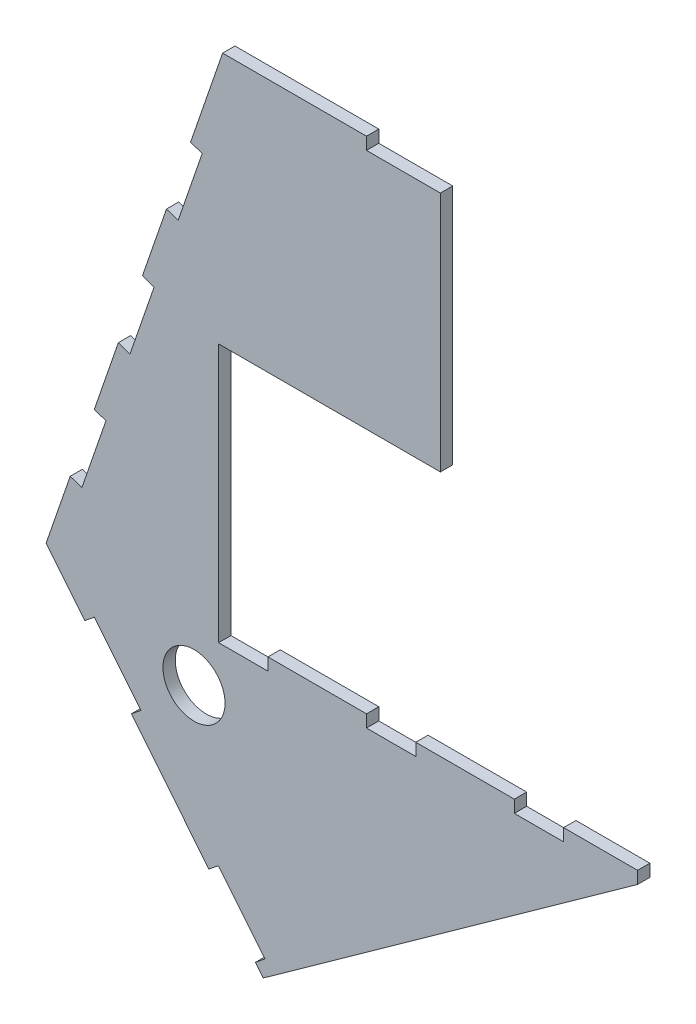
from build123d import *

# Parameters (mm, degrees)
SKETCH1_R           = 8
BOSS_EXTRUDE1_DEPTH = 3.175


with BuildPart() as part:
    # Sketch1 → Boss-Extrude1 (new body)
    with BuildSketch(Plane.XY):
        Polygon((45.481871178, 132.088945011), (37.212440054, 108.072773191), (40.214461532, 107.039094301), (34.01238819, 89.026965435), (31.010366712, 90.060644326), (24.80829337, 72.048515461), (27.810314847, 71.01483657), (21.608241505, 53.002707705), (18.606220027, 54.036386596), (12.404146685, 36.02425773), (15.406168162, 34.99057884), (9.20409482, 16.978449975), (6.202073342, 18.012128865), (0, 0), (9.97035014, -12.312357038), (12.437788568, -10.314264796), (24.426342017, -25.118895362), (21.95890359, -27.116987604), (41.939826006, -51.79137188), (44.407264433, -49.793279638), (56.395817883, -64.597910204), (53.928379455, -66.596002446), (55.946582764, -69.088275974), (152.4, 0), (152.4, 3.175), (133.35, 3.175), (133.35, 0), (120.65, 0), (120.65, 3.175), (95.25, 3.175), (95.25, 0), (82.55, 0), (82.55, 3.175), (57.15, 3.175), (57.15, 0), (44.45, 0), (44.45, 3.175), (44.45, 66.675), (101.6, 66.675), (101.6, 128.913945011), (82.55, 128.913945011), (82.55, 132.088945011), align=None)
        with Locations((38.1, -12.7)):
            Circle(SKETCH1_R, mode=Mode.SUBTRACT)
    extrude(amount=BOSS_EXTRUDE1_DEPTH)


solid = part.part
